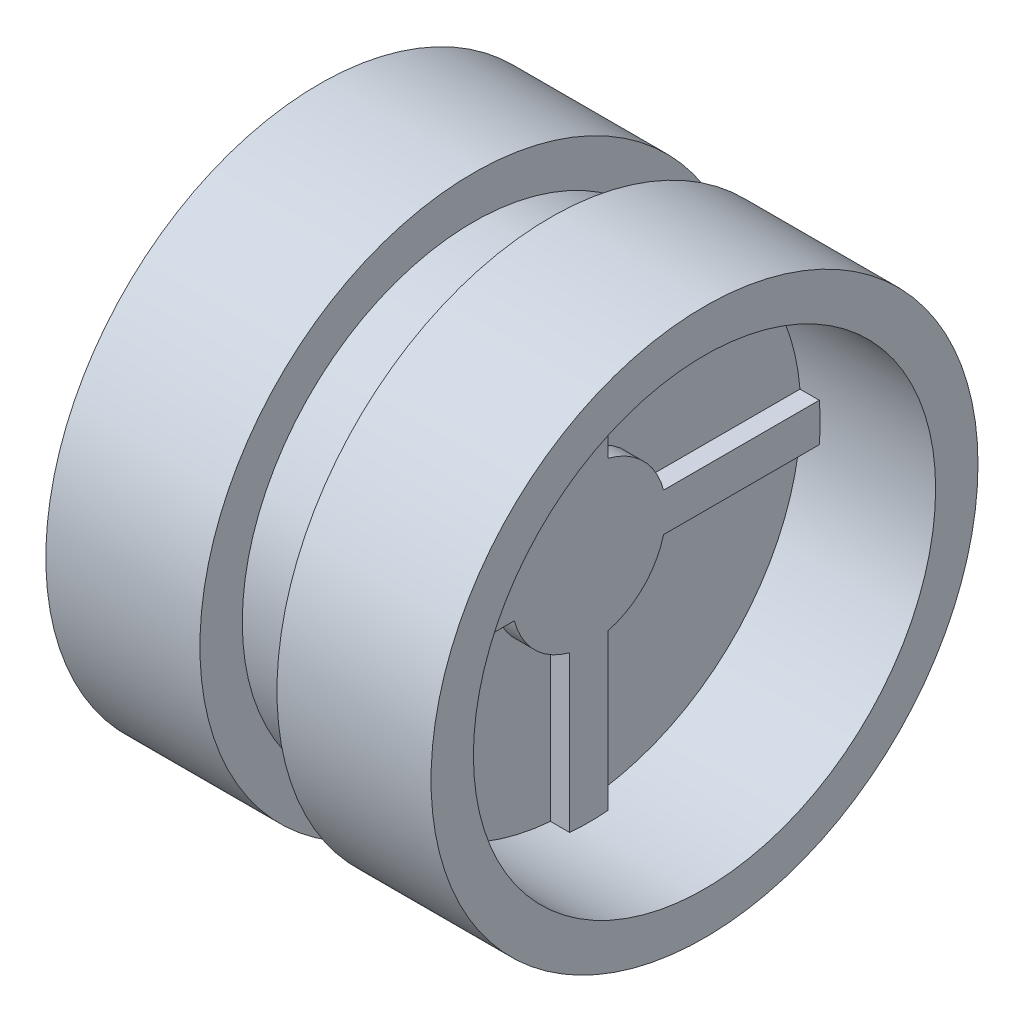
from build123d import *

# Parameters (mm, degrees)
BOSS_EXTRUDE2_DEPTH = 2
SKETCH3_R           = 1.5
CUT_EXTRUDE2_DEPTH  = 5


with BuildPart() as part:
    # Sketch1 → Revolve1 (revolve)
    with BuildSketch(Plane.XY, mode=Mode.PRIVATE) as revolve1_sk:
        Polygon((0, 0), (-5, 0), (-5, 3), (-1.5, 3), (-1.5, 6), (-5, 6), (-5, 7.1), (-1, 7.1), (-1, 6), (1, 6), (1, 7.1), (5, 7.1), (5, 6), (1.5, 6), (1.5, 0), align=None)
    revolve(revolve1_sk.sketch.rotate(Axis((1.5, 0, 0), (-1, 0, 0)), 90), axis=Axis((1.5, 0, 0), (-1, 0, 0)))

    # Sketch2 → Boss-Extrude2 (add)
    with BuildSketch(Plane(origin=(0, 0, 0), x_dir=(0, 0, -1), z_dir=(1, 0, 0))):
        with BuildLine():
            Line((0.5, 1.936491673), (0.5, 5.979130372))
            ThreePointArc((0.5, 5.979130372), (0, 6), (-0.5, 5.979130372))
            Line((-0.5, 5.979130372), (-0.5, 1.936491673))
            ThreePointArc((-0.5, 1.936491673), (-1.414213562, 1.414213562), (-1.936491673, 0.5))
            Line((-1.936491673, 0.5), (-5.979130372, 0.5))
            ThreePointArc((-5.979130372, 0.5), (-6, 0), (-5.979130372, -0.5))
            Line((-5.979130372, -0.5), (-1.936491673, -0.5))
            ThreePointArc((-1.936491673, -0.5), (-1.414213562, -1.414213562), (-0.5, -1.936491673))
            Line((-0.5, -1.936491673), (-0.5, -5.979130372))
            ThreePointArc((-0.5, -5.979130372), (0, -6), (0.5, -5.979130372))
            Line((0.5, -5.979130372), (0.5, -1.936491673))
            ThreePointArc((0.5, -1.936491673), (1.414213562, -1.414213562), (1.936491673, -0.5))
            Line((1.936491673, -0.5), (5.979130372, -0.5))
            ThreePointArc((5.979130372, -0.5), (6, 0), (5.979130372, 0.5))
            Line((5.979130372, 0.5), (1.936491673, 0.5))
            ThreePointArc((1.936491673, 0.5), (1.414213562, 1.414213562), (0.5, 1.936491673))
        make_face()
    extrude(amount=BOSS_EXTRUDE2_DEPTH)

    # Sketch3 → Cut-Extrude2 (cut)
    with BuildSketch(Plane.ZY.offset(5)):
        Circle(SKETCH3_R)
    extrude(amount=-CUT_EXTRUDE2_DEPTH, mode=Mode.SUBTRACT)


solid = part.part
